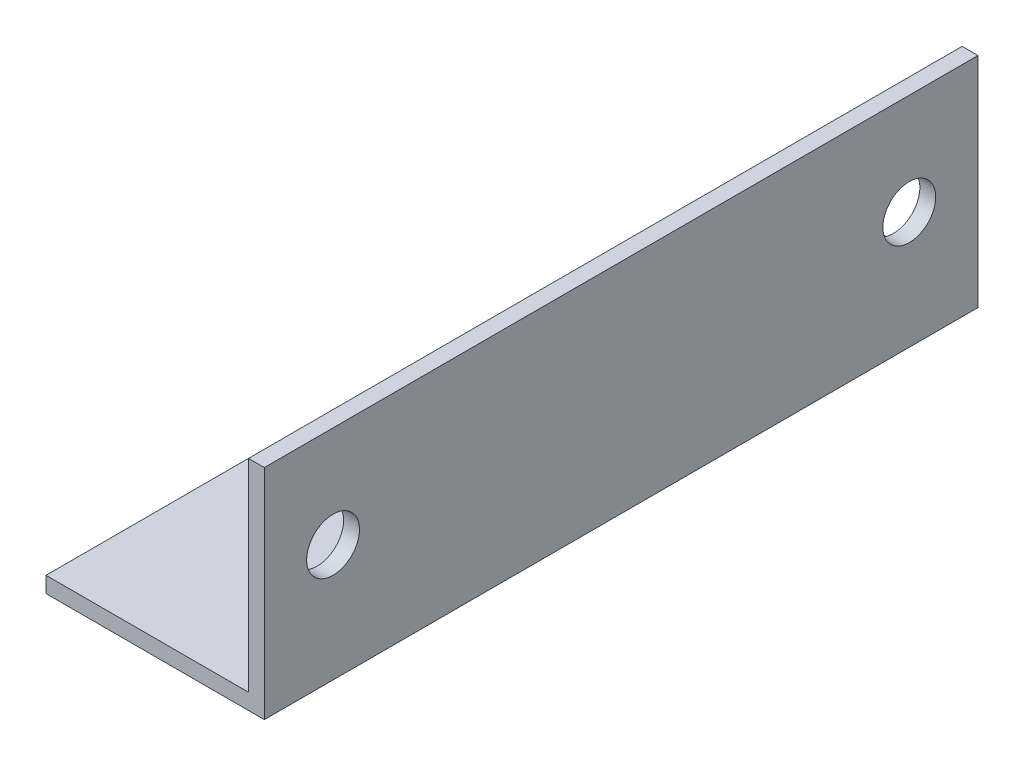
from build123d import *

# Parameters (mm, degrees)
RESSALTO_EXTRUS_O1_DEPTH = 54
CORTE_EXTRUS_O1_START    = 10
ESBO_O2_R                = 2
CORTE_EXTRUS_O1_DEPTH    = 14


with BuildPart() as part:
    # Esboço1 → Ressalto-extrusão1 (new body)
    with BuildSketch(Plane.XY):
        Polygon((0, 0), (16.52, 0), (16.52, 16.52), (15.32, 16.52), (15.32, 1.2), (0, 1.2), align=None)
    extrude(amount=RESSALTO_EXTRUS_O1_DEPTH)

    # Esboço2 → Corte-extrusão1 (cut)
    with BuildSketch(Plane(origin=(0, 0, 0), x_dir=(0, 0, -1), z_dir=(1, 0, 0)).offset(CORTE_EXTRUS_O1_START)):
        with Locations(Location((-5.2, 8.86, 0), (0, 0, 180))):
            Circle(ESBO_O2_R)
        with Locations(Location((-48.8, 8.86, 0), (0, 0, 180))):
            Circle(ESBO_O2_R)
    extrude(amount=CORTE_EXTRUS_O1_DEPTH, mode=Mode.SUBTRACT)


solid = part.part
